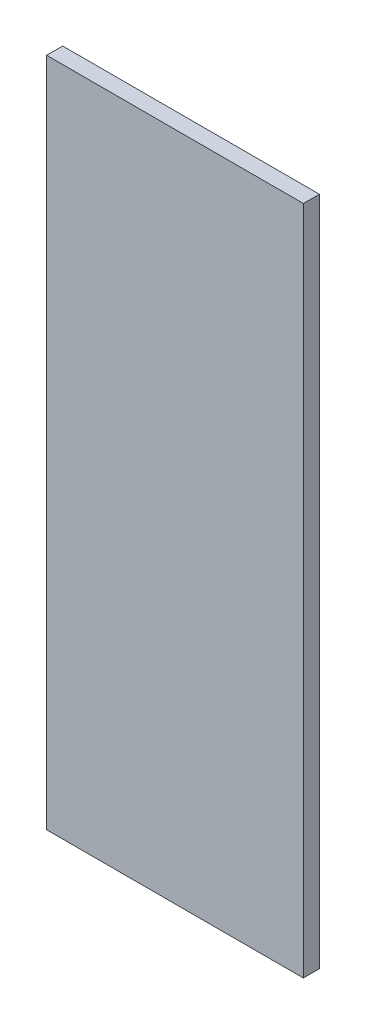
from build123d import *

# Parameters (mm, degrees)
SKETCH_1_W      = 800
SKETCH_1_H      = 2090
EXTRUDE_1_DEPTH = 50


with BuildPart() as part:
    # Эскиз1 → Бобышка-Вытянуть1 (new body)
    with BuildSketch(Plane.XY):
        with Locations((-400, 1045)):
            Rectangle(SKETCH_1_W, SKETCH_1_H)
    extrude(amount=EXTRUDE_1_DEPTH)


solid = part.part
